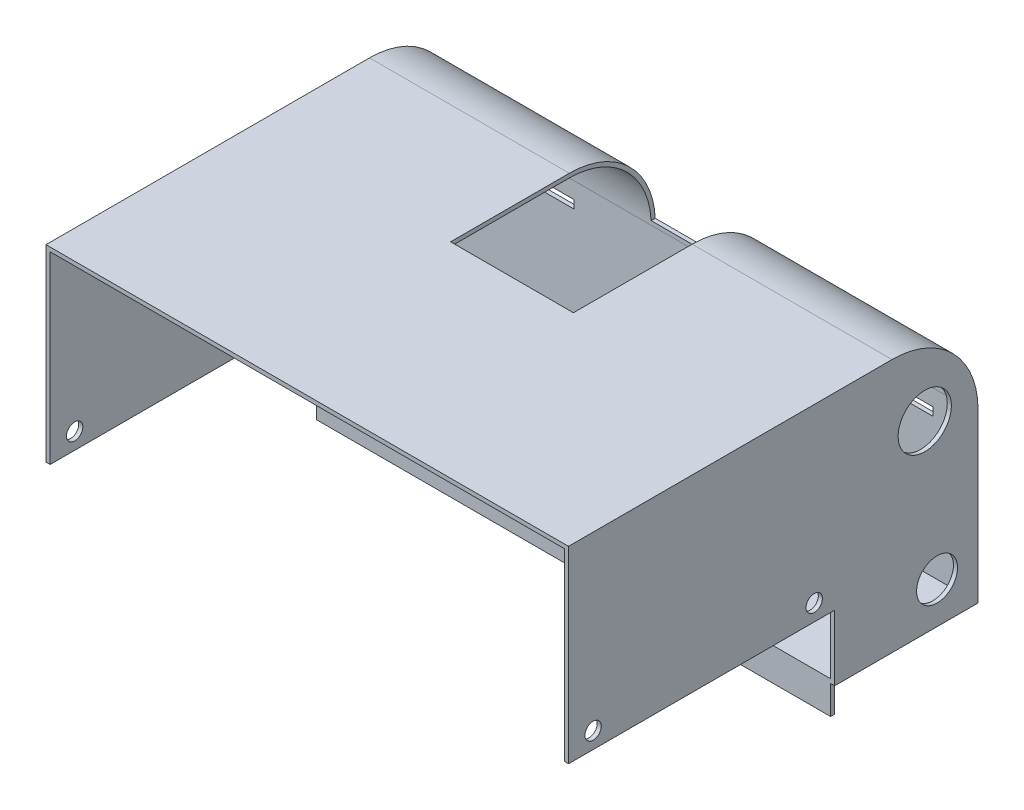
from build123d import *

# Parameters (mm, degrees)
EXTRUDE_1_DEPTH     = 125.6
EXTRUDE_START       = 1
SKETCH_2_R          = 2
EXTRUDE_2_DEPTH     = 1
SKETCH_3_R          = 2
SKETCH_3_R_2        = 6.5
SKETCH_3_R_3        = 5
EXTRUDE_3_DEPTH     = 1
SKETCH_4_W          = 30
SKETCH_4_H          = 50
CUT_EXTRUDE_1_DEPTH = 20
CUT_EXTRUDE_2_REACH = 174.834
SKETCH_5_W          = 20
SKETCH_5_H          = 2
EXTRUDE_START_2     = -23
EXTRUDE_4_DEPTH     = 10


with BuildPart() as part:
    # 草图1 → 凸台-拉伸1 (new body)
    with BuildSketch(Plane(origin=(0, 0, 0), x_dir=(0, 0, -1), z_dir=(1, 0, 0))):
        with BuildLine():
            Line((0, 0), (0, 41))
            ThreePointArc((0, 41), (-6.150757595, 55.849242405), (-21, 62))
            Line((-21, 62), (-100, 62))
            Line((-100, 62), (-100, 61))
            Line((-100, 61), (-21, 61))
            ThreePointArc((-21, 61), (-6.857864376, 55.142135624), (-1, 41))
            Line((-1, 41), (-1, 1))
            Line((-1, 1), (-35, 1))
            Line((-35, 1), (-35, -7))
            Line((-35, -7), (-34, -7))
            Line((-34, -7), (-34, 0))
            Line((-34, 0), (0, 0))
        make_face()
    extrude(amount=EXTRUDE_1_DEPTH)

    # 草图2 → 凸台-拉伸2 (add)
    with BuildSketch(Plane.ZY.offset(EXTRUDE_START)):
        with BuildLine():
            Line((35, 0), (0, 0))
            Line((0, 0), (0, 41))
            ThreePointArc((0, 41), (6.150757595, 55.849242405), (21, 62))
            Line((21, 62), (100, 62))
            Line((100, 62), (100, 16))
            Line((100, 16), (35, 16))
            Line((35, 16), (35, 0))
        make_face()
        with Locations((94, 20)):
            Circle(SKETCH_2_R, mode=Mode.SUBTRACT)
        with Locations((40, 20)):
            Circle(SKETCH_2_R, mode=Mode.SUBTRACT)
    extrude(amount=-EXTRUDE_2_DEPTH)

    # 草图3 → 凸台-拉伸3 (add)
    with BuildSketch(Plane(origin=(125.6, 0, 0), x_dir=(0, 0, -1), z_dir=(1, 0, 0))):
        with BuildLine():
            Line((-35, 16), (-100, 16))
            Line((-100, 16), (-100, 62))
            Line((-100, 62), (-21, 62))
            ThreePointArc((-21, 62), (-6.150757595, 55.849242405), (0, 41))
            Line((0, 41), (0, 0))
            Line((0, 0), (-35, 0))
            Line((-35, 0), (-35, 16))
        make_face()
        with Locations(Location((-94, 20, 0), (0, 0, 180))):
            Circle(SKETCH_3_R, mode=Mode.SUBTRACT)
        with Locations(Location((-40, 20, 0), (0, 0, 180))):
            Circle(SKETCH_3_R, mode=Mode.SUBTRACT)
        with Locations((-13, 45)):
            Circle(SKETCH_3_R_2, mode=Mode.SUBTRACT)
        with Locations((-10, 10)):
            Circle(SKETCH_3_R_3, mode=Mode.SUBTRACT)
    extrude(amount=EXTRUDE_3_DEPTH)

    # 草图4 → 切除-拉伸1 (cut)
    with BuildSketch(Plane(origin=(0, 62, 0), x_dir=(1, 0, 0), z_dir=(0, 1, 0))):
        with Locations((62.8, -25)):
            Rectangle(SKETCH_4_W, SKETCH_4_H)
    extrude(amount=-CUT_EXTRUDE_1_DEPTH, mode=Mode.SUBTRACT)

    # 草图5 → 切除-拉伸2 (cut, up to next)
    with BuildSketch(Plane(origin=(0, 0, 0), x_dir=(-1, 0, 0), z_dir=(0, 0, -1)), mode=Mode.PRIVATE) as cut_extrude_2_sk1:
        with Locations((-106.6, 36)):
            Rectangle(SKETCH_5_W, SKETCH_5_H)
    cut_extrude_2_tool1 = extrude(cut_extrude_2_sk1.sketch, amount=-CUT_EXTRUDE_2_REACH, mode=Mode.PRIVATE) & part.part
    # 草图5 → 切除-拉伸2 (cut, up to next)
    with BuildSketch(Plane(origin=(0, 0, 0), x_dir=(-1, 0, 0), z_dir=(0, 0, -1)), mode=Mode.PRIVATE) as cut_extrude_2_sk2:
        with Locations((-19, 36)):
            Rectangle(SKETCH_5_W, SKETCH_5_H)
    cut_extrude_2_tool2 = extrude(cut_extrude_2_sk2.sketch, amount=-CUT_EXTRUDE_2_REACH, mode=Mode.PRIVATE) & part.part
    add(cut_extrude_2_tool1.solids().sort_by_distance((106.6, 36, 0))[0], mode=Mode.SUBTRACT)
    add(cut_extrude_2_tool2.solids().sort_by_distance((19, 36, 0))[0], mode=Mode.SUBTRACT)

    # 草图6 → 凸台-拉伸4 (add)
    with BuildSketch(Plane(origin=(126.6, 0, 0), x_dir=(0, 0, -1), z_dir=(1, 0, 0)).offset(EXTRUDE_START_2)):
        with BuildLine():
            Line((-10, 16), (0, 16))
            Line((0, 16), (0, 4))
            Line((0, 4), (-10, 4))
            ThreePointArc((-10, 4), (-10.783157153, 4.051330832), (-11.552914271, 4.204445042))
            Line((-11.552914271, 4.204445042), (-11.164685703, 5.653333782))
            ThreePointArc((-11.164685703, 5.653333782), (-5.5, 10), (-11.164685703, 14.346666218))
            Line((-11.164685703, 14.346666218), (-11.552914271, 15.795554958))
            ThreePointArc((-11.552914271, 15.795554958), (-10.783157153, 15.948669168), (-10, 16))
        make_face()
    extrude(amount=-EXTRUDE_4_DEPTH)


solid = part.part
